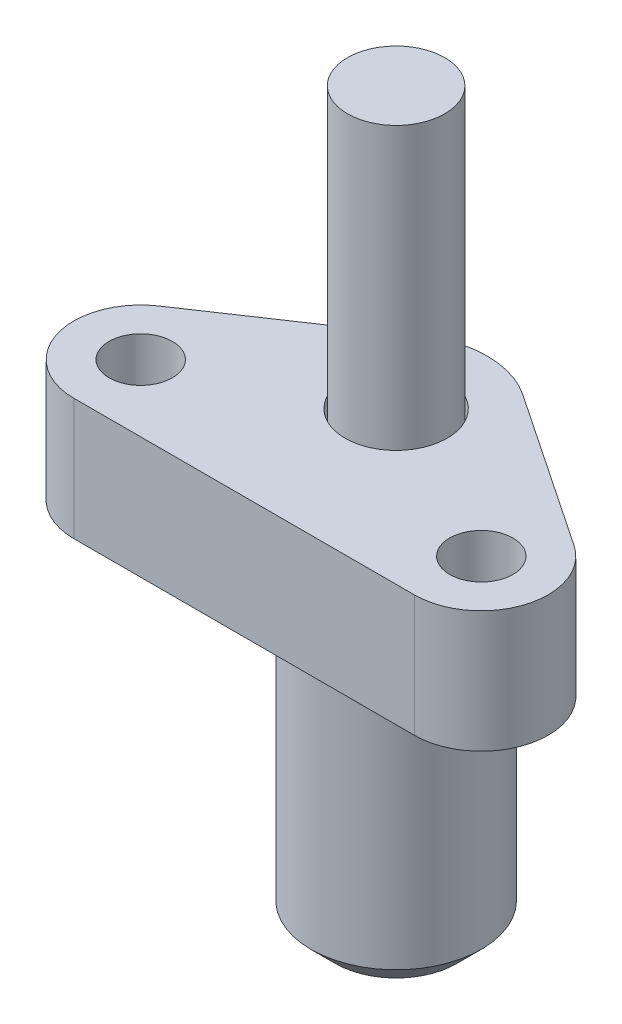
from build123d import *

# Parameters (mm, degrees)
SKETCH_1_R      = 2
EXTRUDE_1_DEPTH = 30
SKETCH_2_R      = 1.3
SKETCH_2_R_2    = 2.1
EXTRUDE_2_DEPTH = 5
SKETCH_3_R      = 3.5
SKETCH_3_R_2    = 2.1
EXTRUDE_4_DEPTH = 13.5
CHAMFER_2_SIZE  = 1
FILLET_2_R      = 0.5


with BuildPart() as part:
    # 草图1 → 凸台-拉伸1 (new body)
    with BuildSketch(Plane(origin=(0, 0, 0), x_dir=(1, 0, 0), z_dir=(0, 1, 0))):
        with Locations(Location((0, 0, 0), (0, 0, 270))):
            Circle(SKETCH_1_R)
    extrude(amount=EXTRUDE_1_DEPTH)


with BuildPart() as body_2:
    # 草图2 → 凸台-拉伸2 (new body)
    with BuildSketch(Plane(origin=(0, 13.5, 0), x_dir=(-1, 0, 0), z_dir=(0, -1, 0))):
        with BuildLine():
            Line((-8.534042298, -1.217629691), (-2.09187586, 3.112323149))
            ThreePointArc((-2.09187586, 3.112323149), (0, 3.75), (2.09187586, 3.112323149))
            Line((2.09187586, 3.112323149), (8.534042298, -1.217629691))
            ThreePointArc((8.534042298, -1.217629691), (9.630495994, -4.301867087), (7, -6.25))
            Line((7, -6.25), (-7, -6.25))
            ThreePointArc((-7, -6.25), (-9.630495994, -4.301867087), (-8.534042298, -1.217629691))
        make_face()
        with Locations(Location((-7, -3.5, 0), (0, 0, 90))):
            Circle(SKETCH_2_R, mode=Mode.SUBTRACT)
        with Locations(Location((7, -3.5, 0), (0, 0, 90))):
            Circle(SKETCH_2_R, mode=Mode.SUBTRACT)
        with Locations(Location((0, 0, 0), (0, 0, 90))):
            Circle(SKETCH_2_R_2, mode=Mode.SUBTRACT)
    extrude(amount=-EXTRUDE_2_DEPTH)

    # 草图3 → 凸台-拉伸4 (add)
    with BuildSketch(Plane.XZ.offset(-13.5)):
        with Locations(Location((0, 0, 0), (0, 0, 90))):
            Circle(SKETCH_3_R)
        with Locations(Location((0, 0, 0), (0, 0, 270))):
            Circle(SKETCH_3_R_2, mode=Mode.SUBTRACT)
    extrude(amount=EXTRUDE_4_DEPTH)

    # 倒角2
    chamfer_2_edges = [body_2.edges().sort_by_distance(p)[0] for p in [
        (0, 0, -3.5),
    ]]
    chamfer(chamfer_2_edges, length=CHAMFER_2_SIZE)

    # 圆角2
    fillet_2_edges = [body_2.edges().sort_by_distance(p)[0] for p in [
        (0, 13.5, -3.5),
    ]]
    fillet(fillet_2_edges, radius=FILLET_2_R)


solid = Compound([part.part, body_2.part])
